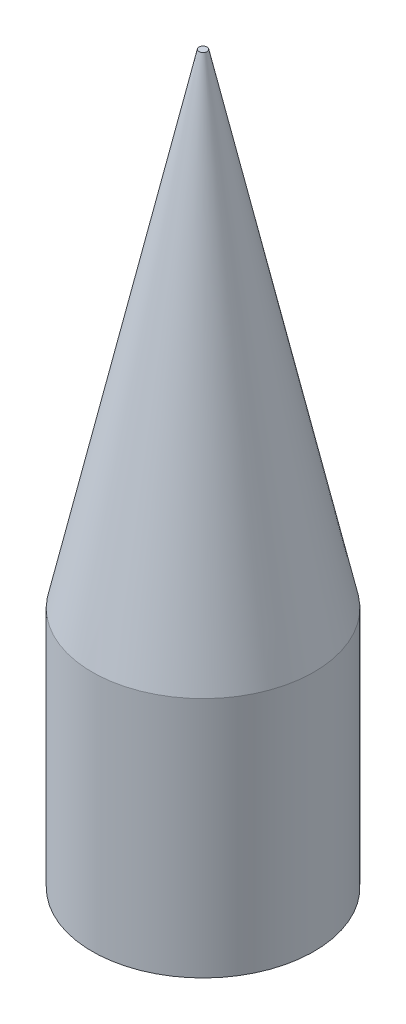
from build123d import *

# Parameters (mm, degrees)
SKETCH3_R           = 27.5
BOSS_EXTRUDE1_DEPTH = 60
SKETCH4_R           = 25
CUT_EXTRUDE1_DEPTH  = 50


with BuildPart() as part:
    # Sketch2 → Revolve1 (revolve)
    with BuildSketch(Plane.XY, mode=Mode.PRIVATE) as revolve1_sk:
        Polygon((0, 0), (0, 120), (1, 120), (27.5, 0), align=None)
    revolve(revolve1_sk.sketch.rotate(Axis((0, 0, 0), (0, 1, 0)), 90), axis=Axis((0, 0, 0), (0, 1, 0)))

    # Sketch3 → Boss-Extrude1 (add)
    with BuildSketch(Plane.XZ):
        with Locations(Location((0, 0, 0), (0, 0, 270))):
            Circle(SKETCH3_R)
    extrude(amount=BOSS_EXTRUDE1_DEPTH)

    # Sketch4 → Cut-Extrude1 (cut)
    with BuildSketch(Plane.XZ.offset(60)):
        with Locations(Location((0, 0, 0), (0, 0, 270))):
            Circle(SKETCH4_R)
    extrude(amount=-CUT_EXTRUDE1_DEPTH, mode=Mode.SUBTRACT)


solid = part.part
